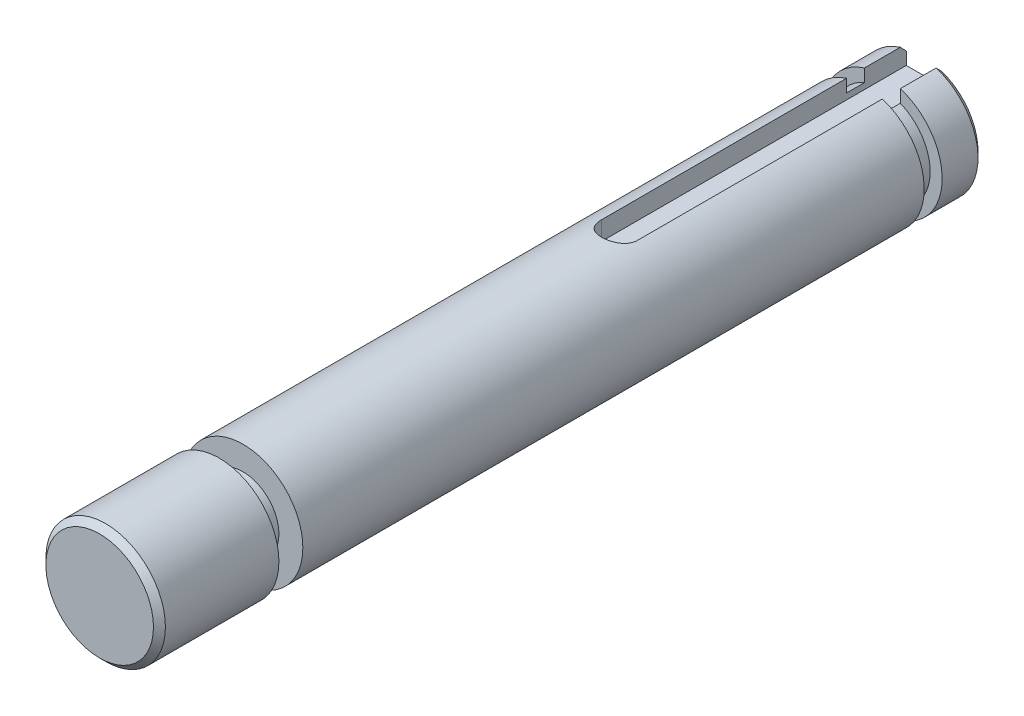
from build123d import *

# Parameters (mm, degrees)
SKETCH1_R           = 5
BOSS_EXTRUDE1_DEPTH = 34.5
CUT_EXTRUDE1_START  = -10
SKETCH2_R           = 5
SKETCH2_R_2         = 3
CUT_EXTRUDE1_DEPTH  = 2
CUT_EXTRUDE3_START  = -5
SKETCH3_R           = 5
SKETCH3_R_2         = 4
CUT_EXTRUDE3_DEPTH  = 1.5
CHAMFER1_SIZE       = 0.5
CUT_EXTRUDE4_START  = 3.2
CUT_EXTRUDE4_DEPTH  = 33.017183306


with BuildPart() as part:
    # Sketch1 → Boss-Extrude1 (new, symmetric)
    with BuildSketch(Plane.XY):
        Circle(SKETCH1_R)
    extrude(amount=BOSS_EXTRUDE1_DEPTH, both=True)

    # Sketch2 → Cut-Extrude1 (cut)
    with BuildSketch(Plane.XY.offset(34.5).offset(CUT_EXTRUDE1_START)):
        Circle(SKETCH2_R)
        Circle(SKETCH2_R_2, mode=Mode.SUBTRACT)
    extrude(amount=-CUT_EXTRUDE1_DEPTH, mode=Mode.SUBTRACT)

    # Sketch3 → Cut-Extrude3 (cut)
    with BuildSketch(Plane(origin=(0, 0, -34.5), x_dir=(-1, 0, 0), z_dir=(0, 0, -1)).offset(CUT_EXTRUDE3_START)):
        Circle(SKETCH3_R)
        Circle(SKETCH3_R_2, mode=Mode.SUBTRACT)
    extrude(amount=CUT_EXTRUDE3_DEPTH, mode=Mode.SUBTRACT)

    # Chamfer1
    chamfer1_edges = [part.edges().sort_by_distance(p)[0] for p in [
        (-5, 0, -34.5),
        (-5, 0, 34.5),
    ]]
    chamfer(chamfer1_edges, length=CHAMFER1_SIZE)

    # Sketch4 → Cut-Extrude4 (cut, through all)
    with BuildSketch(Plane(origin=(0, 0, 0), x_dir=(1, 0, 0), z_dir=(0, 1, 0)).offset(CUT_EXTRUDE4_START)):
        with BuildLine():
            Line((1.5, 34.5), (1.5, 9))
            ThreePointArc((1.5, 9), (0, 7.5), (-1.5, 9))
            Line((-1.5, 9), (-1.5, 34.5))
            Line((-1.5, 34.5), (1.5, 34.5))
        make_face()
    extrude(amount=CUT_EXTRUDE4_DEPTH, mode=Mode.SUBTRACT)


solid = part.part
